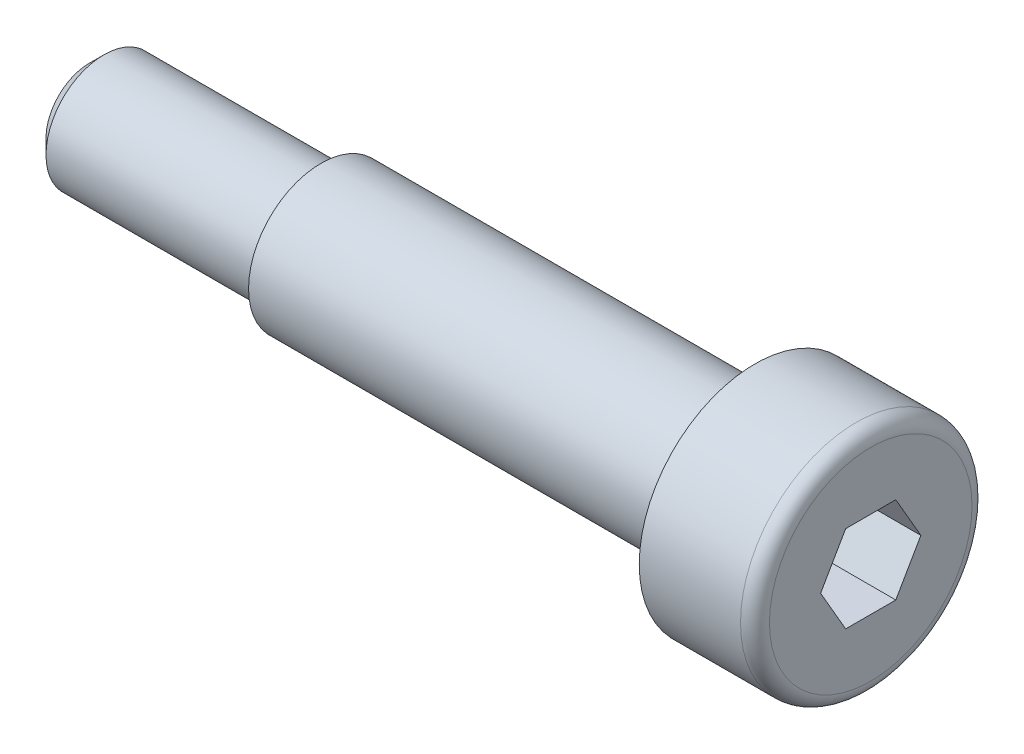
from build123d import *

# Parameters (mm, degrees)
CHAMFER1_SIZE      = 0.5
CUT_EXTRUDE1_DEPTH = 2.4


with BuildPart() as part:
    # Sketch1 → Revolve1 (revolve)
    with BuildSketch(Plane.XY, mode=Mode.PRIVATE) as revolve1_sk:
        with BuildLine():
            Line((0, 0), (0, 3.5))
            ThreePointArc((0, 3.5), (-0.146446609, 3.853553391), (-0.5, 4))
            Line((-0.5, 4), (-4, 4))
            Line((-4, 4), (-4, 2.5))
            Line((-4, 2.5), (-19, 2.5))
            Line((-19, 2.5), (-19, 2))
            Line((-19, 2), (-27, 2))
            Line((-27, 2), (-27, 0))
            Line((-27, 0), (0, 0))
        make_face()
    revolve(revolve1_sk.sketch.rotate(Axis((0, 0, 0), (1, 0, 0)), 90), axis=Axis((0, 0, 0), (1, 0, 0)))

    # Chamfer1
    chamfer1_edges = [part.edges().sort_by_distance(p)[0] for p in [
        (-27, 0, -2),
    ]]
    chamfer(chamfer1_edges, length=CHAMFER1_SIZE)

    # Sketch2 → Cut-Extrude1 (cut)
    with BuildSketch(Plane(origin=(0, 0, 0), x_dir=(0, 0, -1), z_dir=(1, 0, 0))):
        Polygon((1.732050808, 0), (0.866025404, 1.5), (-0.866025404, 1.5), (-1.732050808, 0), (-0.866025404, -1.5), (0.866025404, -1.5), align=None)
    extrude(amount=-CUT_EXTRUDE1_DEPTH, mode=Mode.SUBTRACT)


solid = part.part
